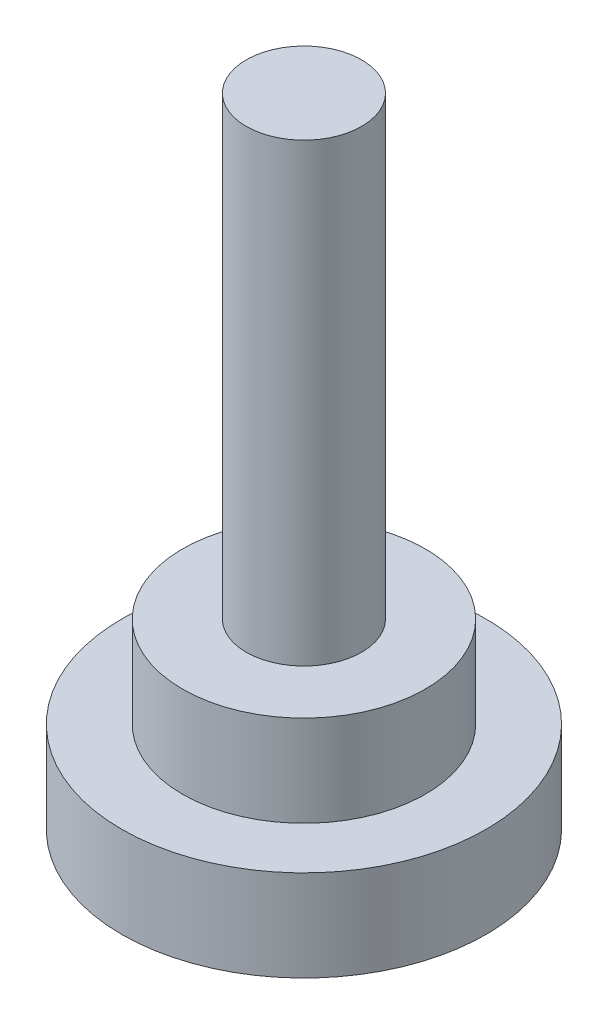
from build123d import *

# Parameters (mm, degrees)
SKETCH1_R           = 6
BOSS_EXTRUDE1_DEPTH = 3
SKETCH2_R           = 1.9
BOSS_EXTRUDE2_DEPTH = 18
SKETCH4_R           = 4
BOSS_EXTRUDE3_DEPTH = 3


with BuildPart() as part:
    # Sketch1 → Boss-Extrude1 (new body)
    with BuildSketch(Plane(origin=(0, 0, 0), x_dir=(1, 0, 0), z_dir=(0, 1, 0))):
        with Locations(Location((0, 0, 0), (0, 0, 270))):
            Circle(SKETCH1_R)
    extrude(amount=BOSS_EXTRUDE1_DEPTH)

    # Sketch2 → Boss-Extrude2 (add)
    with BuildSketch(Plane(origin=(0, 3, 0), x_dir=(1, 0, 0), z_dir=(0, 1, 0))):
        with Locations(Location((0, 0, 0), (0, 0, 270))):
            Circle(SKETCH2_R)
    extrude(amount=BOSS_EXTRUDE2_DEPTH)

    # Sketch4 → Boss-Extrude3 (add)
    with BuildSketch(Plane(origin=(0, 3, 0), x_dir=(1, 0, 0), z_dir=(0, 1, 0))):
        with Locations(Location((0, 0, 0), (0, 0, 270))):
            Circle(SKETCH4_R)
    extrude(amount=BOSS_EXTRUDE3_DEPTH)


solid = part.part
